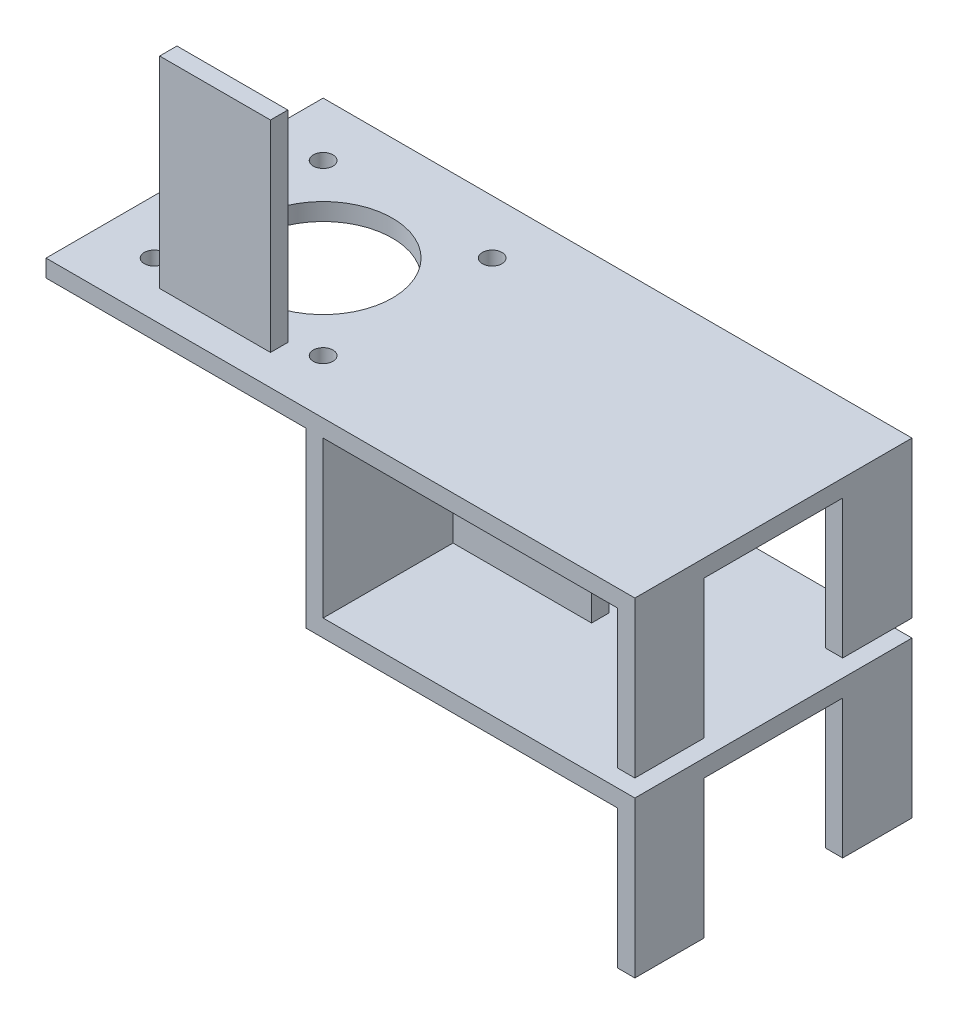
from build123d import *

# Parameters (mm, degrees)
SKETCH1_W            = 50.8
SKETCH1_H            = 50.8
BOSS_EXTRUDE1_DEPTH  = 3.175
SKETCH2_R            = 12.7
SKETCH2_R_2          = 1.8034
CUT_EXTRUDE1_DEPTH   = 37.061067996
SKETCH6_W            = 20.32
SKETCH6_H            = 3.175
BOSS_EXTRUDE4_DEPTH  = 36.9062
SKETCH7_R            = 3.1115
BOSS_EXTRUDE5_DEPTH  = 5.08
SKETCH11_W           = 3.175
SKETCH11_H           = 50.8
BOSS_EXTRUDE8_DEPTH  = 31.75
SKETCH13_W           = 50.8
SKETCH13_H           = 3.175
BOSS_EXTRUDE10_DEPTH = 57.15
SKETCH15_W           = 3.175
SKETCH15_H           = 12.7
BOSS_EXTRUDE12_DEPTH = 25.4
SKETCH16_W           = 3.175
SKETCH16_H           = 12.7
BOSS_EXTRUDE13_DEPTH = 25.4
SKETCH17_W           = 3.175
SKETCH17_H           = 28.575
BOSS_EXTRUDE14_DEPTH = 25.4


with BuildPart() as part:
    # Sketch1 → Boss-Extrude1 (new body)
    with BuildSketch(Plane(origin=(0, 0, 0), x_dir=(1, 0, 0), z_dir=(0, 1, 0))):
        Rectangle(SKETCH1_W, SKETCH1_H)
    extrude(amount=BOSS_EXTRUDE1_DEPTH)

    # Sketch2 → Cut-Extrude1 (cut, through all)
    with BuildSketch(Plane(origin=(0, 3.175, 0), x_dir=(1, 0, 0), z_dir=(0, 1, 0))):
        with Locations(Location((0, 0, 0), (0, 0, 270))):
            Circle(SKETCH2_R)
        with Locations(Location((-15.494, 15.494, 0), (0, 0, 270))):
            Circle(SKETCH2_R_2)
        with Locations(Location((15.494, 15.494, 0), (0, 0, 270))):
            Circle(SKETCH2_R_2)
        with Locations(Location((15.494, -15.494, 0), (0, 0, 270))):
            Circle(SKETCH2_R_2)
        with Locations(Location((-15.494, -15.494, 0), (0, 0, 270))):
            Circle(SKETCH2_R_2)
    extrude(amount=-CUT_EXTRUDE1_DEPTH, mode=Mode.SUBTRACT)

    # Sketch6 → Boss-Extrude4 (add)
    with BuildSketch(Plane(origin=(0, 3.175, 0), x_dir=(1, 0, 0), z_dir=(0, 1, 0))):
        with Locations((0, -18.2245)):
            Rectangle(SKETCH6_W, SKETCH6_H)
    extrude(amount=BOSS_EXTRUDE4_DEPTH)

    # Sketch7 → Boss-Extrude5 (add)
    with BuildSketch(Plane(origin=(0, 0, 16.637), x_dir=(-1, 0, 0), z_dir=(0, 0, -1))):
        with Locations(Location((1.27, 21.6281, 0), (0, 0, 180))):
            Circle(SKETCH7_R)
    extrude(amount=BOSS_EXTRUDE5_DEPTH)

    # Sketch11 → Boss-Extrude8 (add)
    with BuildSketch(Plane.XZ):
        with Locations((23.8125, 0)):
            Rectangle(SKETCH11_W, SKETCH11_H)
    extrude(amount=BOSS_EXTRUDE8_DEPTH)

    # Sketch13 → Boss-Extrude10 (add)
    with BuildSketch(Plane(origin=(25.4, 0, 0), x_dir=(0, 0, -1), z_dir=(1, 0, 0))):
        with Locations((0, -30.1625)):
            Rectangle(SKETCH13_W, SKETCH13_H)
        with Locations((0, 1.5875)):
            Rectangle(SKETCH13_W, SKETCH13_H)
    extrude(amount=BOSS_EXTRUDE10_DEPTH)

    # Sketch15 → Boss-Extrude12 (add)
    with BuildSketch(Plane.XZ.offset(31.75)):
        with Locations((80.9625, 19.05)):
            Rectangle(SKETCH15_W, SKETCH15_H)
        with Locations((80.9625, -19.05)):
            Rectangle(SKETCH15_W, SKETCH15_H)
    extrude(amount=BOSS_EXTRUDE12_DEPTH)

    # Sketch16 → Boss-Extrude13 (add)
    with BuildSketch(Plane.XZ):
        with Locations((80.9625, -19.05)):
            Rectangle(SKETCH16_W, SKETCH16_H)
        with Locations((80.9625, 19.05)):
            Rectangle(SKETCH16_W, SKETCH16_H)
    extrude(amount=BOSS_EXTRUDE13_DEPTH)

    # Sketch17 → Boss-Extrude14 (add)
    with BuildSketch(Plane(origin=(25.4, 0, 0), x_dir=(0, 0, -1), z_dir=(1, 0, 0))):
        with Locations((0, -14.2875)):
            Rectangle(SKETCH17_W, SKETCH17_H)
    extrude(amount=BOSS_EXTRUDE14_DEPTH)


solid = part.part
